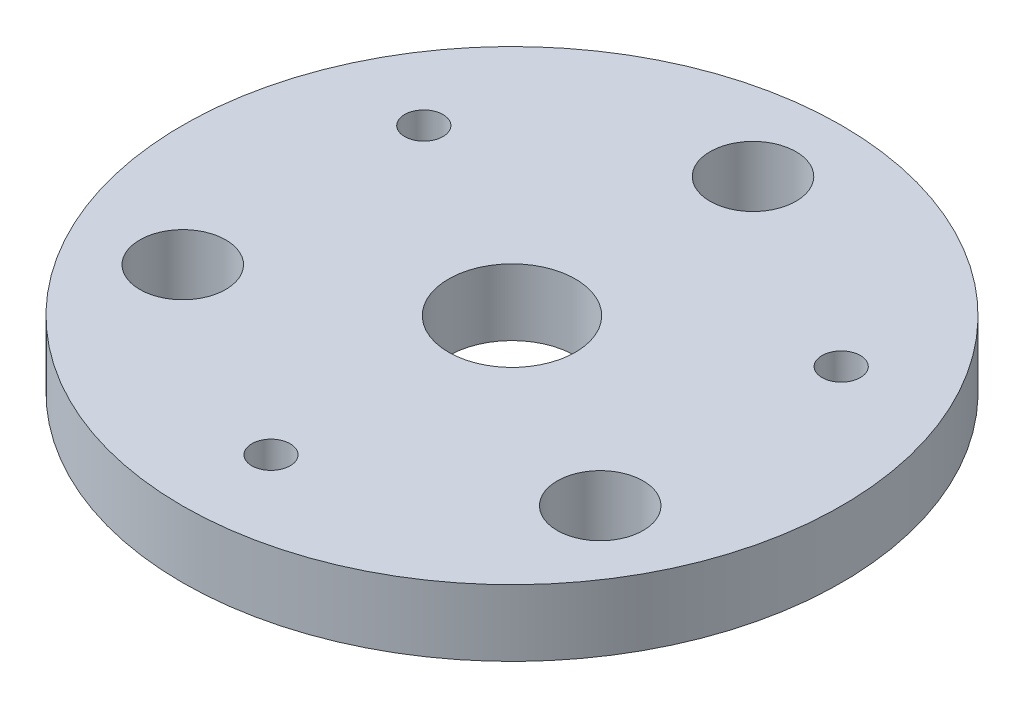
from build123d import *

# Parameters (mm, degrees)
SKETCH1_R               = 38.65245
SKETCH1_R_2             = 7.4422
BOSS_EXTRUDE1_DEPTH     = 3.8989
F_3_8_CLEARANCE_HOLE1_D = 10.0838
F_8_CLEARANCE_HOLE1_D   = 4.4958


with BuildPart() as part:
    # Sketch1 → Boss-Extrude1 (new, symmetric)
    with BuildSketch(Plane(origin=(0, 0, 0), x_dir=(1, 0, 0), z_dir=(0, 1, 0))):
        with Locations(Location((0, 0, 0), (0, 0, 270))):
            Circle(SKETCH1_R)
        with Locations(Location((0, 0, 0), (0, 0, 270))):
            Circle(SKETCH1_R_2, mode=Mode.SUBTRACT)
    extrude(amount=BOSS_EXTRUDE1_DEPTH, both=True)

    # 3/8 Clearance Hole1 (through all)
    with Locations(Plane(origin=(0, 3.8989, 0), x_dir=(1, 0, 0), z_dir=(0, 1, 0))):
        with Locations((0, 28.266203154), (24.47925, -14.133101577), (-24.47925, -14.133101577)):
            Hole(F_3_8_CLEARANCE_HOLE1_D / 2)

    # #8 Clearance Hole1 (through all)
    with Locations(Plane(origin=(0, 3.8989, 0), x_dir=(1, 0, 0), z_dir=(0, 1, 0))):
        with Locations((24.47925, 14.133101577), (0, -28.266203154), (-24.47925, 14.133101577)):
            Hole(F_8_CLEARANCE_HOLE1_D / 2)


solid = part.part
